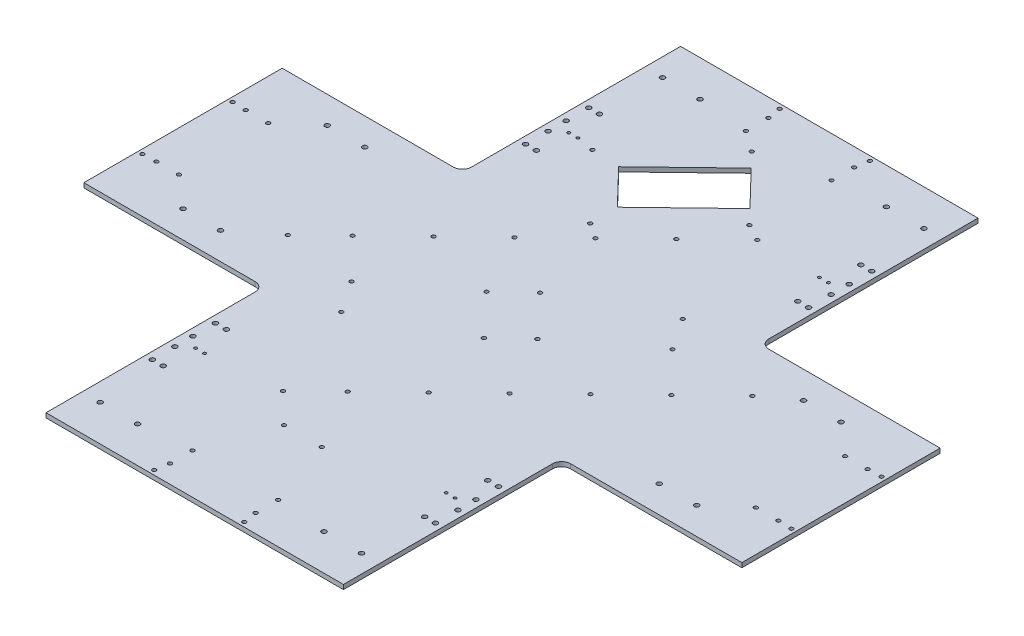
from build123d import *

# Parameters (mm, degrees)
BOSS_EXTRUDE1_DEPTH = 5
SKETCH2_R           = 2.125
CUT_EXTRUDE1_DEPTH  = 3
SKETCH4_R           = 2.6
SKETCH4_R_2         = 1.6
CUT_EXTRUDE3_DEPTH  = 10
SKETCH5_R           = 2.125
CUT_EXTRUDE4_DEPTH  = 10
FILLET1_R           = 10
SKETCH6_R           = 2.6
CUT_EXTRUDE5_DEPTH  = 10
SKETCH7_R           = 2.125
CUT_EXTRUDE6_DEPTH  = 10
SKETCH9_R           = 2.1
CUT_EXTRUDE7_DEPTH  = 10
SKETCH10_R          = 2.125
CUT_EXTRUDE8_DEPTH  = 10
SKETCH11_R          = 2.15
CUT_EXTRUDE9_DEPTH  = 10


with BuildPart() as part:
    # Sketch1 → Boss-Extrude1 (new body)
    with BuildSketch(Plane(origin=(0, 0, 0), x_dir=(1, 0, 0), z_dir=(0, 1, 0))):
        Polygon((165, 352), (-165, 352), (-165, 110), (-365, 110), (-365, -110), (-165, -110), (-165, -352), (165, -352), (165, -110), (365, -110), (365, 110), (165, 110), align=None)
    extrude(amount=BOSS_EXTRUDE1_DEPTH)

    # Sketch2 → Cut-Extrude1 (cut)
    with BuildSketch(Plane(origin=(0, 5, 0), x_dir=(1, 0, 0), z_dir=(0, 1, 0))):
        with Locations(Location((345, 49.5, 0), (0, 0, 270))):
            Circle(SKETCH2_R)
        with Locations(Location((320, 49.5, 0), (0, 0, 270))):
            Circle(SKETCH2_R)
        with Locations(Location((320, -49.5, 0), (0, 0, 90))):
            Circle(SKETCH2_R)
        with Locations(Location((345, -49.5, 0), (0, 0, 90))):
            Circle(SKETCH2_R)
        with Locations(Location((-345, -49.5, 0), (0, 0, 270))):
            Circle(SKETCH2_R)
        with Locations(Location((-320, -49.5, 0), (0, 0, 270))):
            Circle(SKETCH2_R)
        with Locations(Location((-320, 49.5, 0), (0, 0, 90))):
            Circle(SKETCH2_R)
        with Locations(Location((-345, 49.5, 0), (0, 0, 90))):
            Circle(SKETCH2_R)
        with Locations(Location((47.5, 332, 0), (0, 0, 270))):
            Circle(SKETCH2_R)
        with Locations(Location((47.5, 307, 0), (0, 0, 270))):
            Circle(SKETCH2_R)
        with Locations(Location((-47.5, 307, 0), (0, 0, 90))):
            Circle(SKETCH2_R)
        with Locations(Location((-47.5, 332, 0), (0, 0, 90))):
            Circle(SKETCH2_R)
        with Locations(Location((-47.5, -332, 0), (0, 0, 270))):
            Circle(SKETCH2_R)
        with Locations(Location((-47.5, -307, 0), (0, 0, 270))):
            Circle(SKETCH2_R)
        with Locations(Location((47.5, -307, 0), (0, 0, 90))):
            Circle(SKETCH2_R)
        with Locations(Location((47.5, -332, 0), (0, 0, 90))):
            Circle(SKETCH2_R)
    extrude(amount=-CUT_EXTRUDE1_DEPTH, mode=Mode.SUBTRACT)

    # Sketch4 → Cut-Extrude3 (cut)
    with BuildSketch(Plane(origin=(0, 5, 0), x_dir=(1, 0, 0), z_dir=(0, 1, 0))):
        with Locations(Location((-157, 172, 0), (0, 0, 270))):
            Circle(SKETCH4_R)
        with Locations(Location((-145, 172, 0), (0, 0, 270))):
            Circle(SKETCH4_R)
        with Locations(Location((-157, 197, 0), (0, 0, 270))):
            Circle(SKETCH4_R)
        with Locations(Location((-157, 217, 0), (0, 0, 270))):
            Circle(SKETCH4_R)
        with Locations(Location((-157, 242, 0), (0, 0, 270))):
            Circle(SKETCH4_R)
        with Locations(Location((-145, 242, 0), (0, 0, 270))):
            Circle(SKETCH4_R)
        with Locations(Location((145, 242, 0), (0, 0, 90))):
            Circle(SKETCH4_R)
        with Locations(Location((157, 242, 0), (0, 0, 90))):
            Circle(SKETCH4_R)
        with Locations(Location((157, 217, 0), (0, 0, 90))):
            Circle(SKETCH4_R)
        with Locations(Location((157, 197, 0), (0, 0, 90))):
            Circle(SKETCH4_R)
        with Locations(Location((145, 172, 0), (0, 0, 90))):
            Circle(SKETCH4_R)
        with Locations(Location((157, 172, 0), (0, 0, 90))):
            Circle(SKETCH4_R)
        with Locations(Location((157, -172, 0), (0, 0, 270))):
            Circle(SKETCH4_R)
        with Locations(Location((145, -172, 0), (0, 0, 270))):
            Circle(SKETCH4_R)
        with Locations(Location((157, -197, 0), (0, 0, 270))):
            Circle(SKETCH4_R)
        with Locations(Location((157, -217, 0), (0, 0, 270))):
            Circle(SKETCH4_R)
        with Locations(Location((157, -242, 0), (0, 0, 270))):
            Circle(SKETCH4_R)
        with Locations(Location((145, -242, 0), (0, 0, 270))):
            Circle(SKETCH4_R)
        with Locations(Location((-145, -242, 0), (0, 0, 90))):
            Circle(SKETCH4_R)
        with Locations(Location((-157, -242, 0), (0, 0, 90))):
            Circle(SKETCH4_R)
        with Locations(Location((-157, -217, 0), (0, 0, 90))):
            Circle(SKETCH4_R)
        with Locations(Location((-157, -197, 0), (0, 0, 90))):
            Circle(SKETCH4_R)
        with Locations(Location((-145, -172, 0), (0, 0, 90))):
            Circle(SKETCH4_R)
        with Locations(Location((-157, -172, 0), (0, 0, 90))):
            Circle(SKETCH4_R)
        with Locations(Location((144, -207, 0), (0, 0, 270))):
            Circle(SKETCH4_R_2)
        with Locations(Location((-144, -207, 0), (0, 0, 90))):
            Circle(SKETCH4_R_2)
        with Locations(Location((144, 207, 0), (0, 0, 90))):
            Circle(SKETCH4_R_2)
        with Locations(Location((-144, 207, 0), (0, 0, 270))):
            Circle(SKETCH4_R_2)
        with Locations(Location((134, -207, 0), (0, 0, 270))):
            Circle(SKETCH4_R_2)
        with Locations(Location((-134, -207, 0), (0, 0, 90))):
            Circle(SKETCH4_R_2)
        with Locations(Location((134, 207, 0), (0, 0, 90))):
            Circle(SKETCH4_R_2)
        with Locations(Location((-134, 207, 0), (0, 0, 270))):
            Circle(SKETCH4_R_2)
    extrude(amount=-CUT_EXTRUDE3_DEPTH, mode=Mode.SUBTRACT)

    # Sketch5 → Cut-Extrude4 (cut)
    with BuildSketch(Plane(origin=(0, 5, 0), x_dir=(1, 0, 0), z_dir=(0, 1, 0))):
        with Locations(Location((-50, 347, 0), (0, 0, 270))):
            Circle(SKETCH5_R)
        with Locations(Location((50, 347, 0), (0, 0, 270))):
            Circle(SKETCH5_R)
        with Locations(Location((50, -347, 0), (0, 0, 90))):
            Circle(SKETCH5_R)
        with Locations(Location((-50, -347, 0), (0, 0, 90))):
            Circle(SKETCH5_R)
        with Locations(Location((-360, 50, 0), (0, 0, 270))):
            Circle(SKETCH5_R)
        with Locations(Location((-360, -50, 0), (0, 0, 270))):
            Circle(SKETCH5_R)
        with Locations(Location((360, -50, 0), (0, 0, 90))):
            Circle(SKETCH5_R)
        with Locations(Location((360, 50, 0), (0, 0, 90))):
            Circle(SKETCH5_R)
    extrude(amount=-CUT_EXTRUDE4_DEPTH, mode=Mode.SUBTRACT)

    # Fillet1
    fillet1_edges = [part.edges().sort_by_distance(p)[0] for p in [
        (165, 2.5, -110),
        (165, 2.5, 110),
        (-165, 2.5, 110),
        (-165, 2.5, -110),
    ]]
    fillet(fillet1_edges, radius=FILLET1_R)

    # Sketch6 → Cut-Extrude5 (cut)
    with BuildSketch(Plane(origin=(0, 5, 0), x_dir=(1, 0, 0), z_dir=(0, 1, 0))):
        with Locations(Location((-145, 312, 0), (0, 0, 270))):
            Circle(SKETCH6_R)
        with Locations(Location((-103.4, 312, 0), (0, 0, 270))):
            Circle(SKETCH6_R)
        with Locations(Location((103.4, 312, 0), (0, 0, 90))):
            Circle(SKETCH6_R)
        with Locations(Location((145, 312, 0), (0, 0, 90))):
            Circle(SKETCH6_R)
        with Locations(Location((145, -312, 0), (0, 0, 270))):
            Circle(SKETCH6_R)
        with Locations(Location((103.4, -312, 0), (0, 0, 270))):
            Circle(SKETCH6_R)
        with Locations(Location((-103.4, -312, 0), (0, 0, 90))):
            Circle(SKETCH6_R)
        with Locations(Location((-145, -312, 0), (0, 0, 90))):
            Circle(SKETCH6_R)
        with Locations(Location((243.4, 80, 0), (0, 0, 270))):
            Circle(SKETCH6_R)
        with Locations(Location((285, 80, 0), (0, 0, 270))):
            Circle(SKETCH6_R)
        with Locations(Location((285, -80, 0), (0, 0, 90))):
            Circle(SKETCH6_R)
        with Locations(Location((243.4, -80, 0), (0, 0, 90))):
            Circle(SKETCH6_R)
        with Locations(Location((-243.4, -80, 0), (0, 0, 270))):
            Circle(SKETCH6_R)
        with Locations(Location((-285, -80, 0), (0, 0, 270))):
            Circle(SKETCH6_R)
        with Locations(Location((-285, 80, 0), (0, 0, 90))):
            Circle(SKETCH6_R)
        with Locations(Location((-243.4, 80, 0), (0, 0, 90))):
            Circle(SKETCH6_R)
    extrude(amount=-CUT_EXTRUDE5_DEPTH, mode=Mode.SUBTRACT)

    # Sketch7 → Cut-Extrude6 (cut)
    with BuildSketch(Plane(origin=(0, 5, 0), x_dir=(1, 0, 0), z_dir=(0, 1, 0))):
        with Locations(Location((-73.582238948, 76.299764819, 0), (0, 0, 270))):
            Circle(SKETCH7_R)
        with Locations(Location((-27.874360967, 120.379690981, 0), (0, 0, 270))):
            Circle(SKETCH7_R)
        with Locations(Location((17.833517014, 164.459617143, 0), (0, 0, 270))):
            Circle(SKETCH7_R)
        with Locations(Location((63.541394994, 208.539543306, 0), (0, 0, 270))):
            Circle(SKETCH7_R)
        with Locations(Location((-119.290116929, 32.219838656, 0), (0, 0, 270))):
            Circle(SKETCH7_R)
        with Locations(Location((-164.99799491, -11.860087506, 0), (0, 0, 270))):
            Circle(SKETCH7_R)
        with Locations(Location((-201.564297295, -47.124028436, 0), (0, 0, 270))):
            Circle(SKETCH7_R)
        with Locations(Location((-54.399819398, -199.723558073, 0), (0, 0, 90))):
            Circle(SKETCH7_R)
        with Locations(Location((-17.833517014, -164.459617143, 0), (0, 0, 90))):
            Circle(SKETCH7_R)
        with Locations(Location((27.874360967, -120.379690981, 0), (0, 0, 90))):
            Circle(SKETCH7_R)
        with Locations(Location((210.705872891, 55.940013669, 0), (0, 0, 90))):
            Circle(SKETCH7_R)
        with Locations(Location((164.99799491, 11.860087506, 0), (0, 0, 90))):
            Circle(SKETCH7_R)
        with Locations(Location((119.290116929, -32.219838656, 0), (0, 0, 90))):
            Circle(SKETCH7_R)
        with Locations(Location((73.582238948, -76.299764819, 0), (0, 0, 90))):
            Circle(SKETCH7_R)
    extrude(amount=-CUT_EXTRUDE6_DEPTH, mode=Mode.SUBTRACT)

    # Sketch9 → Cut-Extrude7 (cut)
    with BuildSketch(Plane(origin=(0, 5, 0), x_dir=(1, 0, 0), z_dir=(0, 1, 0))):
        with Locations(Location((-121.560496485, -56.440276951, 0), (0, 0, 270))):
            Circle(SKETCH9_R)
        with Locations(Location((-98.122996746, -91.292588295, 0), (0, 0, 270))):
            Circle(SKETCH9_R)
        with Locations(Location((98.122996746, 91.292588295, 0), (0, 0, 270))):
            Circle(SKETCH9_R)
        with Locations(Location((121.560496485, 56.440276951, 0), (0, 0, 270))):
            Circle(SKETCH9_R)
        with Locations(Location((21, 232, 0), (0, 0, 270))):
            Circle(SKETCH9_R)
        with Locations(Location((-21, 232, 0), (0, 0, 90))):
            Circle(SKETCH9_R)
        with Locations(Location((-21, -232, 0), (0, 0, 270))):
            Circle(SKETCH9_R)
        with Locations(Location((21, -232, 0), (0, 0, 90))):
            Circle(SKETCH9_R)
    extrude(amount=-CUT_EXTRUDE7_DEPTH, mode=Mode.SUBTRACT)

    # Sketch10 → Cut-Extrude8 (cut)
    with BuildSketch(Plane(origin=(0, 5, 0), x_dir=(1, 0, 0), z_dir=(0, 1, 0))):
        with Locations(Location((44.976137758, 218.42065903, 0), (0, 0, 270))):
            Circle(SKETCH10_R)
        with Locations(Location((-45, 131.649150836, 0), (0, 0, 270))):
            Circle(SKETCH10_R)
        with Locations(Location((-114.417206555, 203.630061042, 0), (0, 0, 270))):
            Circle(SKETCH10_R)
        with Locations(Location((-24.441068797, 290.401569236, 0), (0, 0, 270))):
            Circle(SKETCH10_R)
        Polygon((-8.822197322, 274.205864439), (29.357266283, 234.616363826), (-45.502880332, 162.422469009), (-83.682343937, 202.011969622), align=None)
    extrude(amount=-CUT_EXTRUDE8_DEPTH, mode=Mode.SUBTRACT)

    # Sketch11 → Cut-Extrude9 (cut)
    with BuildSketch(Plane(origin=(0, 5, 0), x_dir=(1, 0, 0), z_dir=(0, 1, 0))):
        with Locations(Location((-6.187782182, 37.349181406, 0), (0, 0, 270))):
            Circle(SKETCH11_R)
        with Locations(Location((36.856083675, -8.653270834, 0), (0, 0, 90))):
            Circle(SKETCH11_R)
        with Locations(Location((6.187782182, -37.349181406, 0), (0, 0, 270))):
            Circle(SKETCH11_R)
        with Locations(Location((-36.856083675, 8.653270834, 0), (0, 0, 90))):
            Circle(SKETCH11_R)
    extrude(amount=-CUT_EXTRUDE9_DEPTH, mode=Mode.SUBTRACT)


solid = part.part
